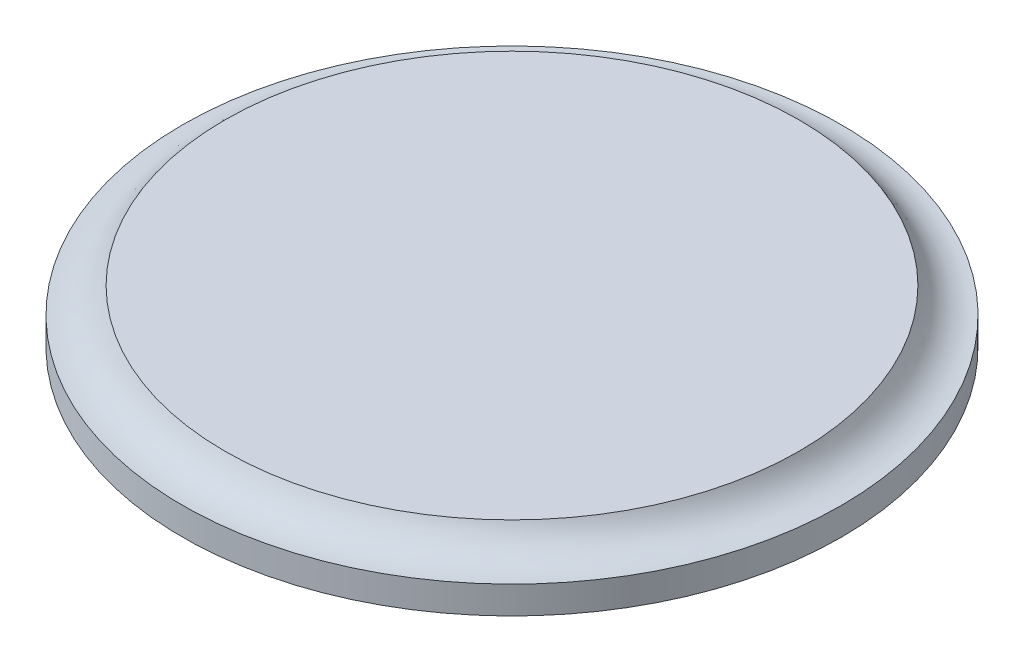
from build123d import *


with BuildPart() as part:
    # Sketch1 → Revolve1 (revolve)
    with BuildSketch(Plane.XY):
        with BuildLine():
            Line((-16.37514541, 2), (2, 2))
            Line((2, 2), (2, 7))
            Line((2, 7), (-25, 7))
            add(Edge.make_bspline(
                [(-29, 4.595569114), (-26.215566128, 4.493938058), (-25, 7)],
                knots=[0, 0, 0, 1, 1, 1], degree=2))
            Line((-29, 4.595569114), (-29, 2))
            Line((-29, 2), (-16.37514541, 2))
        make_face()
        with BuildLine():
            Line((-13.5, 0), (-5, 0))
            Line((-5, 0), (2, 0))
            Line((2, 0), (2, 2))
            Line((2, 2), (-16.37514541, 2))
            add(Edge.make_bspline(
                [(-13.5, 0), (-14.325555034, 1.744460764), (-16.37514541, 2)],
                knots=[0, 0, 0, 1, 1, 1], degree=2))
        make_face()
    revolve(axis=Axis((2, 7, 0), (0, -1, 0)))


solid = part.part
